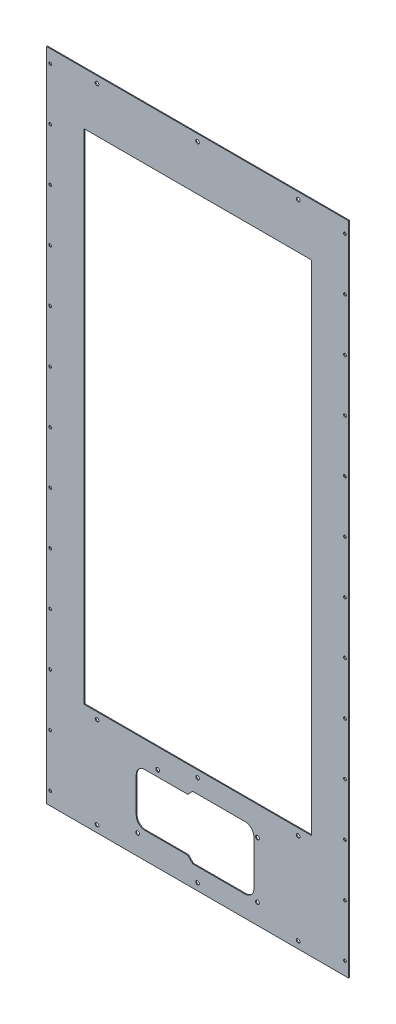
from build123d import *

# Parameters (mm, degrees)
SKETCH1_W           = 345
SKETCH1_H           = 750
SKETCH1_R           = 2.2
SKETCH1_R_2         = 2.1
SKETCH1_W_2         = 260
SKETCH1_H_2         = 570
BOSS_EXTRUDE1_DEPTH = 1
SKETCH2_R           = 1.6
CUT_EXTRUDE1_DEPTH  = 1
SKETCH3_R           = 1.6
CUT_EXTRUDE2_DEPTH  = 1


with BuildPart() as part:
    # Sketch1 → Boss-Extrude1 (new body)
    with BuildSketch(Plane.XY):
        with Locations((-501.064232917, -457.603531907)):
            Rectangle(SKETCH1_W, SKETCH1_H)
        with Locations((-432.564232917, -809.582438144)):
            Circle(SKETCH1_R, mode=Mode.SUBTRACT)
        with Locations((-432.564232917, -745.582438144)):
            Circle(SKETCH1_R, mode=Mode.SUBTRACT)
        with Locations((-546.564232917, -735.582438144)):
            Circle(SKETCH1_R, mode=Mode.SUBTRACT)
        with Locations((-569.564232917, -809.582438144)):
            Circle(SKETCH1_R, mode=Mode.SUBTRACT)
        with Locations((-501.064232917, -90.603531907)):
            Circle(SKETCH1_R_2, mode=Mode.SUBTRACT)
        with Locations((-616.064232917, -90.603531907)):
            Circle(SKETCH1_R_2, mode=Mode.SUBTRACT)
        with Locations((-386.064232917, -90.603531907)):
            Circle(SKETCH1_R_2, mode=Mode.SUBTRACT)
        with Locations((-616.01978091, -720.603531907)):
            Circle(SKETCH1_R_2, mode=Mode.SUBTRACT)
        with Locations((-501.01978091, -720.603531907)):
            Circle(SKETCH1_R_2, mode=Mode.SUBTRACT)
        with Locations((-386.01978091, -720.603531907)):
            Circle(SKETCH1_R_2, mode=Mode.SUBTRACT)
        with Locations((-386.064232917, -824.603531907)):
            Circle(SKETCH1_R_2, mode=Mode.SUBTRACT)
        with Locations((-501.064232917, -824.603531907)):
            Circle(SKETCH1_R_2, mode=Mode.SUBTRACT)
        with Locations((-616.064232917, -824.603531907)):
            Circle(SKETCH1_R_2, mode=Mode.SUBTRACT)
        with Locations((-501.01978091, -427.603531907)):
            Rectangle(SKETCH1_W_2, SKETCH1_H_2, mode=Mode.SUBTRACT)
        with BuildLine():
            Line((-436.704232917, -798.532438144), (-436.704232917, -746.832438144))
            ThreePointArc((-436.704232917, -746.832438144), (-439.633165105, -739.761370332), (-446.704232917, -736.832438144))
            Line((-446.704232917, -736.832438144), (-506.704232917, -736.832438144))
            Line((-506.704232917, -736.832438144), (-512.270368826, -742.582438144))
            Line((-512.270368826, -742.582438144), (-561.204232917, -742.582438144))
            ThreePointArc((-561.204232917, -742.582438144), (-568.275300729, -745.511370332), (-571.204232917, -752.582438144))
            Line((-571.204232917, -752.582438144), (-571.204232917, -792.782438144))
            ThreePointArc((-571.204232917, -792.782438144), (-568.275300729, -799.853505955), (-561.204232917, -802.782438144))
            Line((-561.204232917, -802.782438144), (-512.270368826, -802.782438144))
            Line((-512.270368826, -802.782438144), (-506.704232917, -808.532438144))
            Line((-506.704232917, -808.532438144), (-446.704232917, -808.532438144))
            ThreePointArc((-446.704232917, -808.532438144), (-439.633165105, -805.603505955), (-436.704232917, -798.532438144))
        make_face(mode=Mode.SUBTRACT)
    extrude(amount=BOSS_EXTRUDE1_DEPTH)

    # Sketch2 → Cut-Extrude1 (cut)
    with BuildSketch(Plane.XY.offset(1)):
        with Locations((-669.634232917, -97.603531907)):
            Circle(SKETCH2_R)
        with Locations((-669.634232917, -817.603531907)):
            Circle(SKETCH2_R)
        with Locations((-669.634232917, -757.603531907)):
            Circle(SKETCH2_R)
        with Locations((-669.634232917, -697.603531907)):
            Circle(SKETCH2_R)
        with Locations((-669.634232917, -637.603531907)):
            Circle(SKETCH2_R)
        with Locations((-669.634232917, -577.603531907)):
            Circle(SKETCH2_R)
        with Locations((-669.634232917, -517.603531907)):
            Circle(SKETCH2_R)
        with Locations((-669.634232917, -457.603531907)):
            Circle(SKETCH2_R)
        with Locations((-669.634232917, -397.603531907)):
            Circle(SKETCH2_R)
        with Locations((-669.634232917, -337.603531907)):
            Circle(SKETCH2_R)
        with Locations((-669.634232917, -277.603531907)):
            Circle(SKETCH2_R)
        with Locations((-669.634232917, -217.603531907)):
            Circle(SKETCH2_R)
        with Locations((-669.634232917, -157.603531907)):
            Circle(SKETCH2_R)
    extrude(amount=-CUT_EXTRUDE1_DEPTH, mode=Mode.SUBTRACT)

    # Sketch3 → Cut-Extrude2 (cut)
    with BuildSketch(Plane.XY.offset(1)):
        with Locations((-332.514232917, -97.603531907)):
            Circle(SKETCH3_R)
        with Locations((-332.514232917, -817.603531907)):
            Circle(SKETCH3_R)
        with Locations((-332.514232917, -757.603531907)):
            Circle(SKETCH3_R)
        with Locations((-332.514232917, -697.603531907)):
            Circle(SKETCH3_R)
        with Locations((-332.514232917, -637.603531907)):
            Circle(SKETCH3_R)
        with Locations((-332.514232917, -577.603531907)):
            Circle(SKETCH3_R)
        with Locations((-332.514232917, -517.603531907)):
            Circle(SKETCH3_R)
        with Locations((-332.514232917, -457.603531907)):
            Circle(SKETCH3_R)
        with Locations((-332.514232917, -397.603531907)):
            Circle(SKETCH3_R)
        with Locations((-332.514232917, -337.603531907)):
            Circle(SKETCH3_R)
        with Locations((-332.514232917, -277.603531907)):
            Circle(SKETCH3_R)
        with Locations((-332.514232917, -217.603531907)):
            Circle(SKETCH3_R)
        with Locations((-332.514232917, -157.603531907)):
            Circle(SKETCH3_R)
    extrude(amount=-CUT_EXTRUDE2_DEPTH, mode=Mode.SUBTRACT)


solid = part.part
